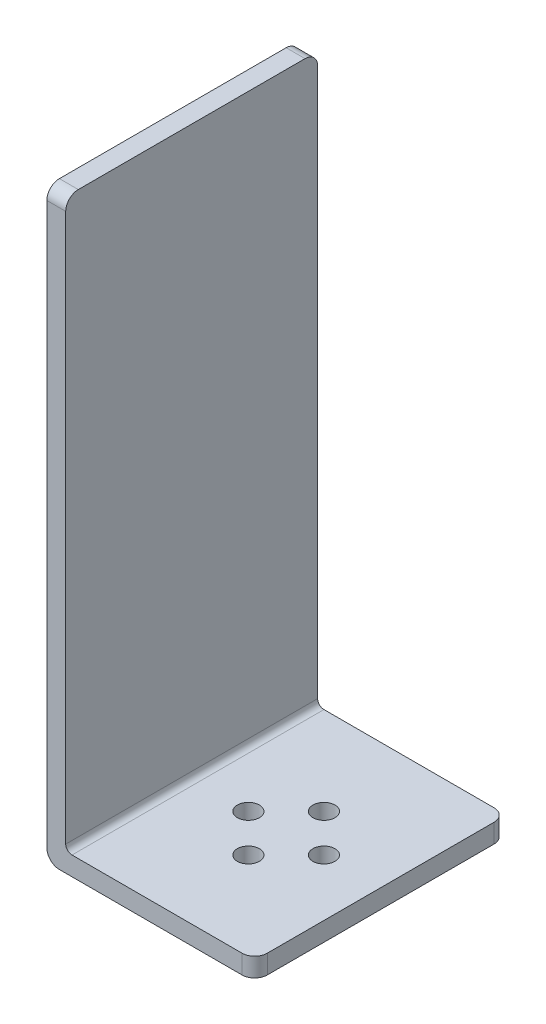
from build123d import *

# Parameters (mm, degrees)
EXTRU_MINCE1_DEPTH      = 40
CONG_1_R                = 1
CONG_2_R                = 2
CONG_3_R                = 2
CONG_4_R                = 2
CONG_5_R                = 2
CONG_6_R                = 2
ESQUISSE3_R             = 1.75
ENL_V_MAT_EXTRU_2_DEPTH = 10


with BuildPart() as part:
    # Esquisse1 → Extru.-Mince1 (new body)
    with BuildSketch(Plane.XY):
        Polygon((30, 0), (0, 0), (0, 90), (-3, 90), (-3, -3), (30, -3), align=None)
    extrude(amount=EXTRU_MINCE1_DEPTH)

    # Congé1
    cong_1_edges = [part.edges().sort_by_distance(p)[0] for p in [
        (0, 0, 20),
    ]]
    fillet(cong_1_edges, radius=CONG_1_R)

    # Congé2
    cong_2_edges = [part.edges().sort_by_distance(p)[0] for p in [
        (-3, -3, 20),
    ]]
    fillet(cong_2_edges, radius=CONG_2_R)

    # Congé3
    cong_3_edges = [part.edges().sort_by_distance(p)[0] for p in [
        (-1.5, 90, 40),
    ]]
    fillet(cong_3_edges, radius=CONG_3_R)

    # Congé4
    cong_4_edges = [part.edges().sort_by_distance(p)[0] for p in [
        (-1.5, 90, 0),
    ]]
    fillet(cong_4_edges, radius=CONG_4_R)

    # Congé5
    cong_5_edges = [part.edges().sort_by_distance(p)[0] for p in [
        (30, -1.5, 40),
    ]]
    fillet(cong_5_edges, radius=CONG_5_R)

    # Congé6
    cong_6_edges = [part.edges().sort_by_distance(p)[0] for p in [
        (30, -1.5, 0),
    ]]
    fillet(cong_6_edges, radius=CONG_6_R)

    # Esquisse3 → Enlèv. mat.-Extru.2 (cut)
    with BuildSketch(Plane(origin=(0, 0, 0), x_dir=(1, 0, 0), z_dir=(0, 1, 0))):
        with Locations(Location((15, -14, 0), (0, 0, 270))):
            Circle(ESQUISSE3_R)
        with Locations(Location((15, -26, 0), (0, 0, 270))):
            Circle(ESQUISSE3_R)
        with Locations(Location((21, -20, 0), (0, 0, 270))):
            Circle(ESQUISSE3_R)
        with Locations(Location((9, -20, 0), (0, 0, 270))):
            Circle(ESQUISSE3_R)
    extrude(amount=-ENL_V_MAT_EXTRU_2_DEPTH, mode=Mode.SUBTRACT)


solid = part.part
